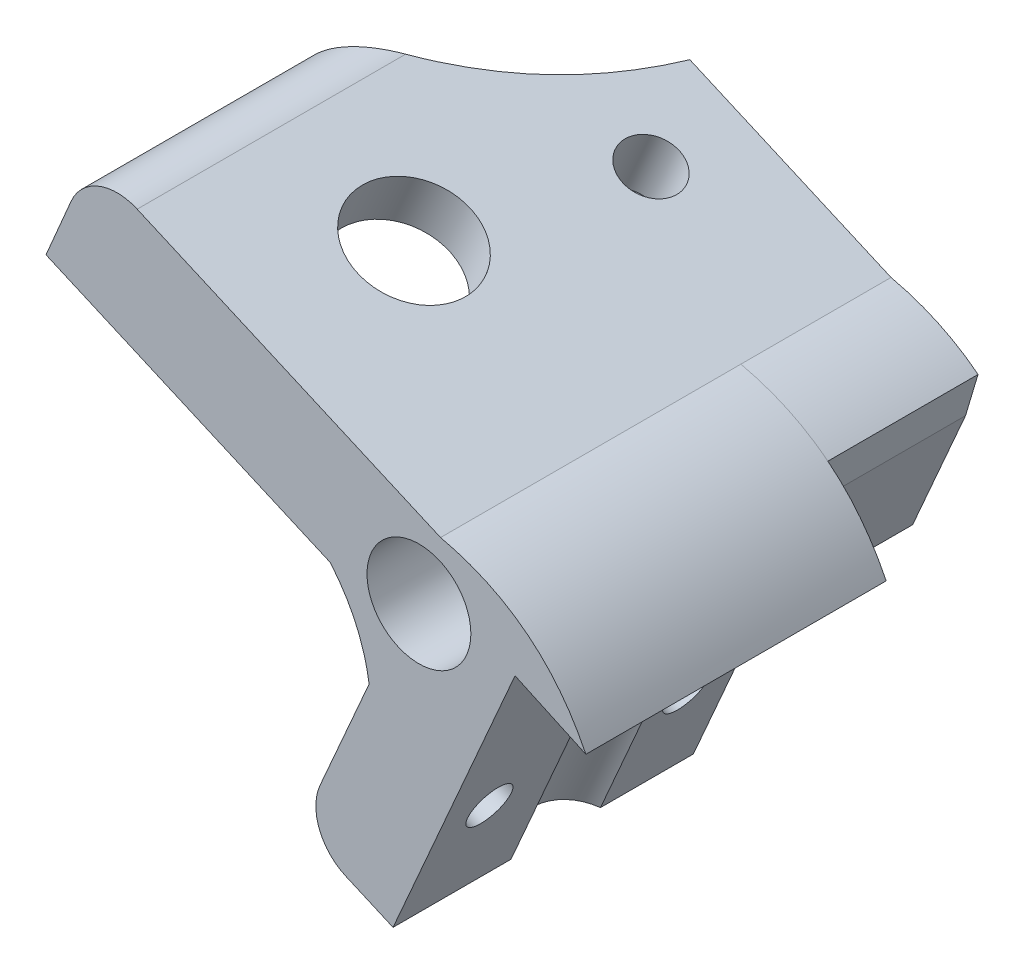
from build123d import *

# Parameters (mm, degrees)
SKETCH1_R           = 4.15
BOSS_EXTRUDE1_DEPTH = 24
BOSS_EXTRUDE2_DEPTH = 12
SKETCH4_R           = 2.25
CUT_EXTRUDE1_DEPTH  = 51.135027226
CUT_EXTRUDE2_DEPTH  = 51.135027226
SKETCH6_R           = 10.9
CUT_EXTRUDE3_DEPTH  = 5
SKETCH7_R           = 4.5
CUT_EXTRUDE4_DEPTH  = 5
CUT_EXTRUDE5_REACH  = 58.104
SKETCH8_R           = 4.1
SKETCH10_R          = 3.25
CUT_EXTRUDE6_DEPTH  = 4
SKETCH11_R          = 1.75
CUT_EXTRUDE7_DEPTH  = 14


with BuildPart() as part:
    # Sketch1 → Boss-Extrude1 (new body)
    with BuildSketch(Plane.XY):
        with BuildLine():
            Line((13.341629993, -3.742589758), (7.682372306, -1.136974107))
            Line((7.682372306, -1.136974107), (-2.0678902, -23.426775412))
            Line((-2.0678902, -23.426775412), (-5.840324092, -21.776593778))
            ThreePointArc((-5.840324092, -21.776593778), (-7.962146661, -19.569683724), (-7.901980723, -16.508807532))
            Line((-7.901980723, -16.508807532), (-3.98023327, -7.54341081))
            add(Edge.make_bspline(
                [(-7.080436324, -0.68533899), (-4.531901983, -3.715550368), (-3.98023327, -7.54341081)],
                knots=[0, 0, 0, 1, 1, 1], degree=2))
            Line((-7.080436324, -0.68533899), (-29.803412918, 9.254408057))
            Line((-29.803412918, 9.254408057), (-27.798908258, 13.960167121))
            ThreePointArc((-27.798908258, 13.960167121), (-25.594658653, 16.110387521), (-22.515803889, 16.057307996))
            Line((-22.515803889, 16.057307996), (1.72881799, 5.451945282))
            add(Edge.make_bspline(
                [(1.72881799, 5.451945282), (9.747838199, 3.631364235), (13.341629993, -3.742589758)],
                knots=[0, 0, 0, 1, 1, 1], degree=2))
        make_face()
        Circle(SKETCH1_R, mode=Mode.SUBTRACT)
    extrude(amount=-BOSS_EXTRUDE1_DEPTH)

    # Sketch3 → Boss-Extrude2 (add)
    with BuildSketch(Plane(origin=(0, 0, -24), x_dir=(-1, 0, 0), z_dir=(0, 0, -1))):
        with BuildLine():
            Line((-7.682372306, -1.136974107), (-8.679331285, 2.212996201))
            add(Edge.make_bspline(
                [(-1.728818003, 5.451945279), (-5.764462803, 4.535721319), (-8.679331285, 2.212996201)],
                knots=[0, 0, 0, 1, 1, 1], degree=2))
            Line((-1.728818003, 5.451945279), (22.515803889, 16.057307996))
            ThreePointArc((22.515803889, 16.057307996), (25.594658653, 16.110387521), (27.798908258, 13.960167121))
            Line((27.798908258, 13.960167121), (28.304096394, 12.774191506))
            Line((28.304096394, 12.774191506), (3.510718988, 2.212996201))
            ThreePointArc((3.510718988, 2.212996201), (-3.681374953, -1.915718783), (3.826915418, 1.605371728))
            Line((3.826915418, 1.605371728), (28.62962492, 12.009983349))
            Line((28.62962492, 12.009983349), (29.803412918, 9.254408057))
            Line((29.803412918, 9.254408057), (7.080436358, -0.685338949))
            add(Edge.make_bspline(
                [(3.98023327, -7.54341081), (4.531901987, -3.715550342), (7.080436358, -0.685338949)],
                knots=[0, 0, 0, 1, 1, 1], degree=2))
            Line((3.98023327, -7.54341081), (-3.456922061, -10.796657252))
            Line((-3.456922061, -10.796657252), (-7.682372306, -1.136974107))
        make_face()
    extrude(amount=BOSS_EXTRUDE2_DEPTH)

    # Sketch4 → Cut-Extrude1 (cut, through all)
    with BuildSketch(Plane(origin=(-1.388852746, -3.17501726, 0), x_dir=(0.9161803596748023, -0.40076620185109174, 0), z_dir=(-0.4007662018510917, -0.9161803596748022, 0))):
        with Locations(Location((-13.70758094, -28.823038163, 0), (0, 0, 180))):
            Circle(SKETCH4_R)
    extrude(amount=-CUT_EXTRUDE1_DEPTH, mode=Mode.SUBTRACT)

    # Sketch5 → Cut-Extrude2 (cut, through all)
    with BuildSketch(Plane(origin=(-1.388852746, -3.17501726, 0), x_dir=(0.9161803596748023, -0.40076620185109174, 0), z_dir=(-0.4007662018510917, -0.9161803596748022, 0))):
        with BuildLine():
            Line((-18.149274911, -36), (-34.697304605, -37.023423696))
            Line((-34.697304605, -37.023423696), (-31.063763643, -18.422303423))
            add(Edge.make_bspline(
                [(-18.149274911, -36), (-21.35728774, -24.660432841), (-31.063763643, -18.422303423)],
                knots=[0, 0, 0, 1, 1, 1], degree=2))
        make_face()
    extrude(amount=-CUT_EXTRUDE2_DEPTH, mode=Mode.SUBTRACT)

    # Sketch6 → Cut-Extrude3 (cut)
    with BuildSketch(Plane(origin=(-1.388852746, -3.17501726, 0), x_dir=(0.9161803596748023, -0.40076620185109174, 0), z_dir=(-0.4007662018510917, -0.9161803596748022, 0))):
        with Locations((-17, -12.900000194)):
            Circle(SKETCH6_R)
    extrude(amount=-CUT_EXTRUDE3_DEPTH, mode=Mode.SUBTRACT)

    # Sketch7 → Cut-Extrude4 (cut)
    with BuildSketch(Plane(origin=(2.279484819, 5.211066233, 0), x_dir=(0.9161803596748023, -0.40076620185109163, 0), z_dir=(0.40076620185109163, 0.9161803596748023, 0))):
        with Locations(Location((-17, 12.900000194, 0), (0, 0, 180))):
            Circle(SKETCH7_R)
    extrude(amount=-CUT_EXTRUDE4_DEPTH, mode=Mode.SUBTRACT)

    # Cut-Extrude5: up to this plane
    cut_extrude5_end = Plane(origin=(13.341629993, -3.742589758, -24), z_dir=(-0.41821784159009956, -0.9083467603155299, 0))
    # Sketch8 → Cut-Extrude5 (cut, up to the surface)
    with BuildSketch(Plane(origin=(-8.933836899, -20.423393653, 0), x_dir=(0.9161803596748023, -0.4007662018510919, 0), z_dir=(-0.40076620185109185, -0.9161803596748022, 0)), mode=Mode.PRIVATE) as cut_extrude5_sk1:
        with Locations((9.5, -13.000000223)):
            Circle(SKETCH8_R)
    cut_extrude5_tool1 = split(extrude(cut_extrude5_sk1.sketch, amount=-CUT_EXTRUDE5_REACH, mode=Mode.PRIVATE), bisect_by=cut_extrude5_end, keep=Keep.BOTH, mode=Mode.PRIVATE)
    add(cut_extrude5_tool1.solids().sort_by_distance((-0.230123, -24.230673, -13))[0], mode=Mode.SUBTRACT)

    # Sketch10 → Cut-Extrude6 (cut)
    with BuildSketch(Plane(origin=(-0.571208632, 0.249864682, 0), x_dir=(0, 0, 1), z_dir=(-0.9161803596748025, 0.4007662018510913, 0))):
        with Locations(Location((-4.1353862, -13.399079912, 0), (0, 0, 270))):
            Circle(SKETCH10_R)
        with Locations(Location((-19.8646138, -13.399079912, 0), (0, 0, 270))):
            Circle(SKETCH10_R)
    extrude(amount=-CUT_EXTRUDE6_DEPTH, mode=Mode.SUBTRACT)

    # Sketch11 → Cut-Extrude7 (cut)
    with BuildSketch(Plane(origin=(3.093512806, -1.353200126, 0), x_dir=(0, 0, 1), z_dir=(-0.9161803596748025, 0.40076620185109135, 0))):
        with Locations(Location((-4.1353862, -13.399079912, 0), (0, 0, 270))):
            Circle(SKETCH11_R)
        with Locations(Location((-19.8646138, -13.399079912, 0), (0, 0, 270))):
            Circle(SKETCH11_R)
    extrude(amount=-CUT_EXTRUDE7_DEPTH, mode=Mode.SUBTRACT)


solid = part.part
